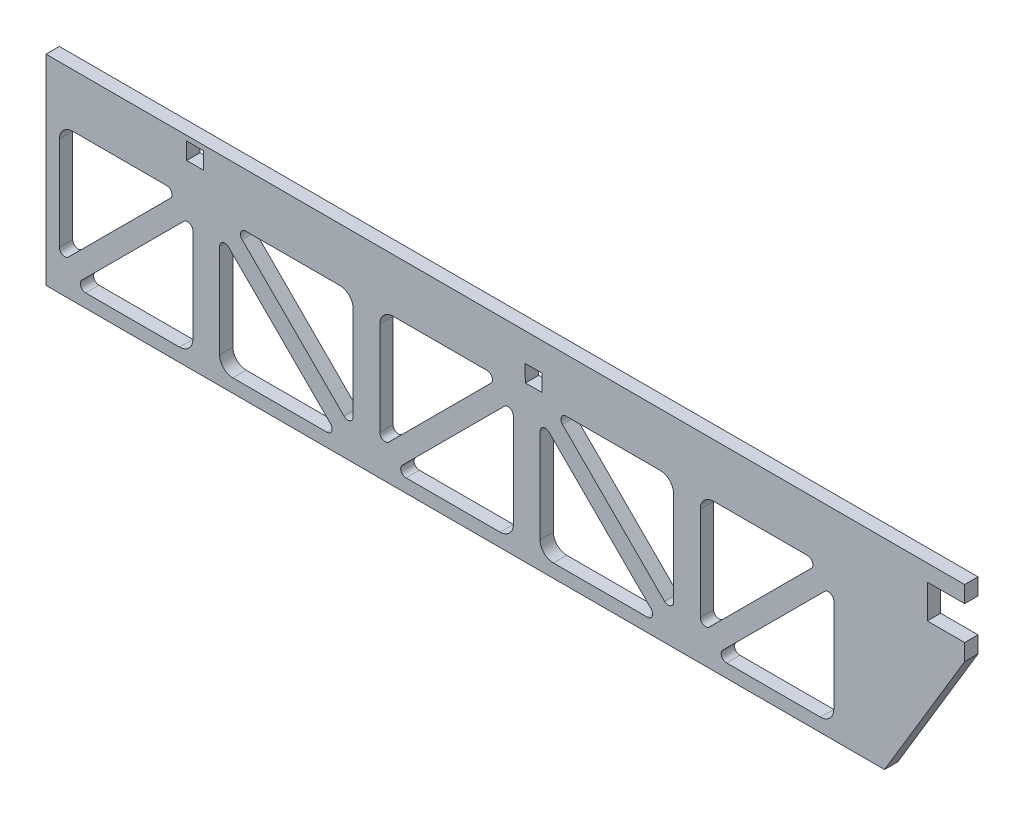
from build123d import *

# Parameters (mm, degrees)
MODEL_W             = 8.001
MODEL_H             = 8.001
BOSS_EXTRUDE2_DEPTH = 6.35


with BuildPart() as part:
    # Model → Boss-Extrude2 (new body)
    with BuildSketch(Plane.XY):
        Polygon((419.1, 87.376), (419.1, 71.374), (436.88, 71.374), (436.88, 63.5), (398.78, 0), (0, 0), (0, 95.25), (436.88, 95.25), (436.88, 87.376), align=None)
        with Locations((70.891200524, 88.9)):
            Rectangle(MODEL_W, MODEL_H, mode=Mode.SUBTRACT)
        Polygon((235.853706977, 81.865965064), (235.938184476, 73.865411048), (227.937630461, 73.780933549), (227.853152962, 81.781487564), align=None, mode=Mode.SUBTRACT)
        with BuildLine():
            Line((171.232102448, 6.35), (215.9, 6.35))
            ThreePointArc((215.9, 6.35), (220.390128061, 8.209871939), (222.25, 12.7))
            Line((222.25, 12.7), (222.25, 57.367897552))
            ThreePointArc((222.25, 57.367897552), (220.682015918, 59.714551565), (217.913948776, 59.163948776))
            Line((217.913948776, 59.163948776), (169.436051224, 10.686051224))
            ThreePointArc((169.436051224, 10.686051224), (168.885448435, 7.917984082), (171.232102448, 6.35))
        make_face(mode=Mode.SUBTRACT)
        with BuildLine():
            Line((234.95, 57.367897552), (234.95, 12.7))
            ThreePointArc((234.95, 12.7), (236.809871939, 8.209871939), (241.3, 6.35))
            Line((241.3, 6.35), (285.967897552, 6.35))
            ThreePointArc((285.967897552, 6.35), (288.314551565, 7.917984082), (287.763948776, 10.686051224))
            Line((287.763948776, 10.686051224), (239.286051224, 59.163948776))
            ThreePointArc((239.286051224, 59.163948776), (236.517984082, 59.714551565), (234.95, 57.367897552))
        make_face(mode=Mode.SUBTRACT)
        with BuildLine():
            Line((294.113948776, 17.036051224), (245.636051224, 65.513948776))
            ThreePointArc((245.636051224, 65.513948776), (245.085448435, 68.282015918), (247.432102448, 69.85))
            Line((247.432102448, 69.85), (292.1, 69.85))
            ThreePointArc((292.1, 69.85), (296.590128061, 67.990128061), (298.45, 63.5))
            Line((298.45, 63.5), (298.45, 18.832102448))
            ThreePointArc((298.45, 18.832102448), (296.882015918, 16.485448435), (294.113948776, 17.036051224))
        make_face(mode=Mode.SUBTRACT)
        with BuildLine():
            Line((323.632102448, 6.35), (368.3, 6.35))
            ThreePointArc((368.3, 6.35), (372.790128061, 8.209871939), (374.65, 12.7))
            Line((374.65, 12.7), (374.65, 57.367897552))
            ThreePointArc((374.65, 57.367897552), (373.082015918, 59.714551565), (370.313948776, 59.163948776))
            Line((370.313948776, 59.163948776), (321.836051224, 10.686051224))
            ThreePointArc((321.836051224, 10.686051224), (321.285448435, 7.917984082), (323.632102448, 6.35))
        make_face(mode=Mode.SUBTRACT)
        with BuildLine():
            Line((18.832102448, 6.35), (63.5, 6.35))
            ThreePointArc((63.5, 6.35), (67.990128061, 8.209871939), (69.85, 12.7))
            Line((69.85, 12.7), (69.85, 57.367897552))
            ThreePointArc((69.85, 57.367897552), (68.282015918, 59.714551565), (65.513948776, 59.163948776))
            Line((65.513948776, 59.163948776), (17.036051224, 10.686051224))
            ThreePointArc((17.036051224, 10.686051224), (16.485448435, 7.917984082), (18.832102448, 6.35))
        make_face(mode=Mode.SUBTRACT)
        with BuildLine():
            Line((82.55, 57.367897552), (82.55, 12.7))
            ThreePointArc((82.55, 12.7), (84.409871939, 8.209871939), (88.9, 6.35))
            Line((88.9, 6.35), (133.567897552, 6.35))
            ThreePointArc((133.567897552, 6.35), (135.914551565, 7.917984082), (135.363948776, 10.686051224))
            Line((135.363948776, 10.686051224), (86.886051224, 59.163948776))
            ThreePointArc((86.886051224, 59.163948776), (84.117984082, 59.714551565), (82.55, 57.367897552))
        make_face(mode=Mode.SUBTRACT)
        with BuildLine():
            Line((93.236051224, 65.513948776), (141.713948776, 17.036051224))
            ThreePointArc((141.713948776, 17.036051224), (144.482015918, 16.485448435), (146.05, 18.832102448))
            Line((146.05, 18.832102448), (146.05, 63.5))
            ThreePointArc((146.05, 63.5), (144.190128061, 67.990128061), (139.7, 69.85))
            Line((139.7, 69.85), (95.032102448, 69.85))
            ThreePointArc((95.032102448, 69.85), (92.685448435, 68.282015918), (93.236051224, 65.513948776))
        make_face(mode=Mode.SUBTRACT)
        with BuildLine():
            Line((163.086051224, 17.036051224), (211.563948776, 65.513948776))
            ThreePointArc((211.563948776, 65.513948776), (212.114551565, 68.282015918), (209.767897552, 69.85))
            Line((209.767897552, 69.85), (165.1, 69.85))
            ThreePointArc((165.1, 69.85), (160.609871939, 67.990128061), (158.75, 63.5))
            Line((158.75, 63.5), (158.75, 18.832102448))
            ThreePointArc((158.75, 18.832102448), (160.317984082, 16.485448435), (163.086051224, 17.036051224))
        make_face(mode=Mode.SUBTRACT)
        with BuildLine():
            Line((315.486051224, 17.036051224), (363.963948776, 65.513948776))
            ThreePointArc((363.963948776, 65.513948776), (364.514551565, 68.282015918), (362.167897552, 69.85))
            Line((362.167897552, 69.85), (317.5, 69.85))
            ThreePointArc((317.5, 69.85), (313.009871939, 67.990128061), (311.15, 63.5))
            Line((311.15, 63.5), (311.15, 18.832102448))
            ThreePointArc((311.15, 18.832102448), (312.717984082, 16.485448435), (315.486051224, 17.036051224))
        make_face(mode=Mode.SUBTRACT)
        with BuildLine():
            Line((6.35, 63.5), (6.35, 18.832102448))
            ThreePointArc((6.35, 18.832102448), (7.917984082, 16.485448435), (10.686051224, 17.036051224))
            Line((10.686051224, 17.036051224), (59.163948776, 65.513948776))
            ThreePointArc((59.163948776, 65.513948776), (59.714551565, 68.282015918), (57.367897552, 69.85))
            Line((57.367897552, 69.85), (12.7, 69.85))
            ThreePointArc((12.7, 69.85), (8.209871939, 67.990128061), (6.35, 63.5))
        make_face(mode=Mode.SUBTRACT)
    extrude(amount=BOSS_EXTRUDE2_DEPTH)


solid = part.part
